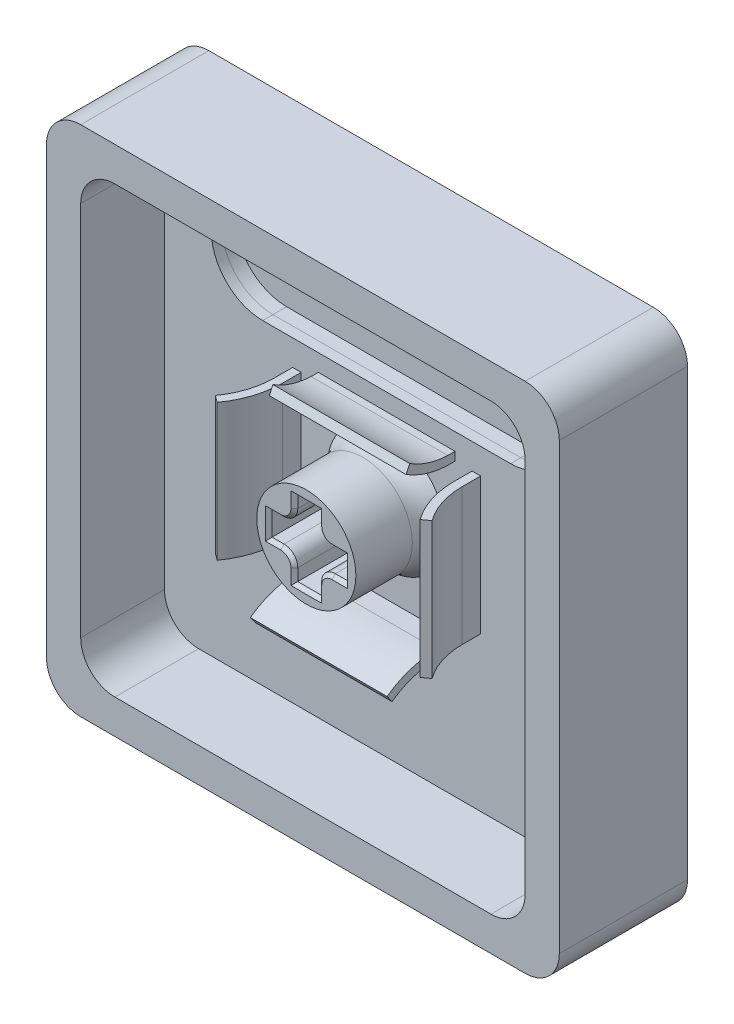
from build123d import *

# Parameters (mm, degrees)
EXTRUDE_1_DEPTH          = 5.5
SKETCH_1_6_R             = 2.9
EXTRUDE_2_DEPTH          = 5.3
EXTRUDE_START            = -2
EXTRUDE_3_DEPTH          = 2
EXTRUDE_4_DEPTH          = 2
CUT_EXTRUDE_1_REACH      = 23.915
EXTRUDE_6_DEPTH          = 1.2
EXTRUDE_9_DEPTH          = 4
EXTRUDE_13_DEPTH         = 4
FILLET_4_R               = 0.8
CHAMFER_1_SIZE           = 0.2
FILLET_5_R               = 2
EXTRUDE_10_DEPTH         = 0.6
PATTERN_CIRCULAR_6_COUNT = 3
PATTERN_CIRCULAR_6_ANGLE = 180


with BuildPart() as part:
    # 草图1 → 凸台-拉伸1 (new body)
    with BuildSketch(Plane.XY):
        with BuildLine():
            ThreePointArc((-15, 13), (-14.414213562, 14.414213562), (-13, 15))
            Line((-13, 15), (13, 15))
            ThreePointArc((13, 15), (14.414213562, 14.414213562), (15, 13))
            Line((15, 13), (15, -13))
            ThreePointArc((15, -13), (14.414213562, -14.414213562), (13, -15))
            Line((13, -15), (-13, -15))
            ThreePointArc((-13, -15), (-14.414213562, -14.414213562), (-15, -13))
            Line((-15, -13), (-15, 13))
        make_face()
        with BuildLine():
            ThreePointArc((-13, -11), (-12.414213562, -12.414213562), (-11, -13))
            Line((-11, -13), (11, -13))
            ThreePointArc((11, -13), (12.414213562, -12.414213562), (13, -11))
            Line((13, -11), (13, 11))
            ThreePointArc((13, 11), (12.414213562, 12.414213562), (11, 13))
            Line((11, 13), (-11, 13))
            ThreePointArc((-11, 13), (-12.414213562, 12.414213562), (-13, 11))
            Line((-13, 11), (-13, -11))
        make_face(mode=Mode.SUBTRACT)
    extrude(amount=EXTRUDE_1_DEPTH)



with BuildPart() as body_2:
    # 草图1<6> → 凸台-拉伸2 (new body)
    with BuildSketch(Plane.XY):
        Circle(SKETCH_1_6_R)
        Polygon((-2.2, -0.7), (-2.2, 0.7), (-0.7, 0.7), (-0.7, 2.2), (0.7, 2.2), (0.7, 0.7), (2.2, 0.7), (2.2, -0.7), (0.7, -0.7), (0.7, -2.2), (-0.7, -2.2), (-0.7, -0.7), align=None, mode=Mode.SUBTRACT)
    extrude(amount=EXTRUDE_2_DEPTH)


with BuildPart() as part_1:
    add(part.part)

    add(body_2.part)  # 凸台-拉伸3 merges body 2
    # 草图1<7> → 凸台-拉伸3 (add)
    with BuildSketch(Plane.XY.offset(EXTRUDE_START)):
        with BuildLine():
            Line((-13, 15), (13, 15))
            ThreePointArc((13, 15), (14.414213562, 14.414213562), (15, 13))
            Line((15, 13), (15, -13))
            ThreePointArc((15, -13), (14.414213562, -14.414213562), (13, -15))
            Line((13, -15), (-13, -15))
            ThreePointArc((-13, -15), (-14.414213562, -14.414213562), (-15, -13))
            Line((-15, -13), (-15, 13))
            ThreePointArc((-15, 13), (-14.414213562, 14.414213562), (-13, 15))
        make_face()
    extrude(amount=EXTRUDE_3_DEPTH)

    # 草图3 → 凸台-拉伸4 (add)
    with BuildSketch(Plane.XY):
        Polygon((0.7, 0.7), (0.7, 2.2), (-0.7, 2.2), (-0.7, 0.7), (-2.2, 0.7), (-2.2, -0.7), (-0.7, -0.7), (-0.7, -2.2), (0.7, -2.2), (0.7, -0.7), (2.2, -0.7), (2.2, 0.7), align=None)
    extrude(amount=EXTRUDE_4_DEPTH)

    # 草图5 → 切除-拉伸1 (cut, up to next)
    with BuildSketch(Plane.XY, mode=Mode.PRIVATE) as cut_extrude_1_sk1:
        with BuildLine():
            Line((7.25, 5.5), (-7.25, 5.5))
            ThreePointArc((-7.25, 5.5), (-10.25, 8.5), (-7.25, 11.5))
            Line((-7.25, 11.5), (7.25, 11.5))
            ThreePointArc((7.25, 11.5), (10.25, 8.5), (7.25, 5.5))
        make_face()
    cut_extrude_1_tool1 = extrude(cut_extrude_1_sk1.sketch, amount=-CUT_EXTRUDE_1_REACH, mode=Mode.PRIVATE) & part_1.part
    add(cut_extrude_1_tool1.solids().sort_by_distance((0, 8.5, 0))[0], mode=Mode.SUBTRACT)

    # 圆角4
    fillet_4_edges = [part_1.edges().sort_by_distance(p)[0] for p in [
        (0.7, 0.7, 3.65),
        (0.7, -0.7, 3.65),
        (-0.7, -0.7, 3.65),
        (-0.7, 0.7, 3.65),
    ]]
    fillet(fillet_4_edges, radius=FILLET_4_R)

    # 倒角1
    chamfer_1_edges = [part_1.edges().sort_by_distance(p)[0] for p in [
        (1.85, 0.7, 5.3),
        (1.85, -0.7, 5.3),
        (0.7, -1.85, 5.3),
        (-0.7, -1.85, 5.3),
        (0.934314575, -0.934314575, 5.3),
        (-0.934314575, -0.934314575, 5.3),
        (0.934314575, 0.934314575, 5.3),
        (-0.934314575, 0.934314575, 5.3),
        (0, -2.2, 5.3),
        (-1.85, -0.7, 5.3),
        (-2.2, 0, 5.3),
        (-0.7, 1.85, 5.3),
        (0, 2.2, 5.3),
        (0.7, 1.85, 5.3),
        (2.2, 0, 5.3),
        (-1.85, 0.7, 5.3),
    ]]
    chamfer(chamfer_1_edges, length=CHAMFER_1_SIZE)

    # 圆角5
    fillet_5_edges = [part_1.edges().sort_by_distance(p)[0] for p in [
        (-2.9, 0, 0),
    ]]
    fillet(fillet_5_edges, radius=FILLET_5_R)


with BuildPart() as body_2_2:
    # 草图6 → 凸台-拉伸6 (new body)
    with BuildSketch(Plane(origin=(0, 0, -2), x_dir=(-1, 0, 0), z_dir=(0, 0, -1))):
        with BuildLine():
            Line((7.25, 5.5), (-7.25, 5.5))
            ThreePointArc((-7.25, 5.5), (-10.25, 8.5), (-7.25, 11.5))
            Line((-7.25, 11.5), (7.25, 11.5))
            ThreePointArc((7.25, 11.5), (10.25, 8.5), (7.25, 5.5))
        make_face()
    extrude(amount=-EXTRUDE_6_DEPTH)


with BuildPart() as body_3:
    # 草图9 → 凸台-拉伸9 (new, symmetric)
    with BuildSketch(Plane(origin=(0, 0, 0), x_dir=(1, 0, 0), z_dir=(0, 1, 0))):
        with BuildLine():
            Line((5.93522135, -4.576441313), (6.340698731, -4.283886885))
            ThreePointArc((6.340698731, -4.283886885), (5.715390829, -3.049095715), (5.5, -1.681862744))
            Line((5.5, -1.681862744), (5.5, 1.163381533))
            Line((5.5, 1.163381533), (5, 1.163381533))
            Line((5, 1.163381533), (5, -1.681862744))
            ThreePointArc((5, -1.681862744), (5.239607953, -3.20281837), (5.93522135, -4.576441313))
        make_face()
    extrude(amount=EXTRUDE_9_DEPTH, both=True)


with BuildPart() as body_4:
    # 草图12 → 凸台-拉伸13 (new, symmetric)
    with BuildSketch(Plane.ZY):
        with BuildLine():
            Line((-1.163381533, 4.5), (-1.163381533, 4))
            Line((-1.163381533, 4), (1.02162113, 4))
            ThreePointArc((1.02162113, 4), (2.293168275, 4.216705202), (3.46547282, 4.754752913))
            Line((3.46547282, 4.754752913), (3.251979945, 5.206882089))
            ThreePointArc((3.251979945, 5.206882089), (2.184122002, 4.704132062), (1.02162113, 4.5))
            Line((1.02162113, 4.5), (-1.163381533, 4.5))
        make_face()
    extrude(amount=EXTRUDE_13_DEPTH, both=True)


with BuildPart() as body_5:
    # 草图10 → 凸台-拉伸10 (new body)
    with BuildSketch(Plane.XY):
        with BuildLine():
            Line((-13, 11), (-13, -11))
            ThreePointArc((-13, -11), (-12.414213562, -12.414213562), (-11, -13))
            Line((-11, -13), (11, -13))
            ThreePointArc((11, -13), (12.414213562, -12.414213562), (13, -11))
            Line((13, -11), (13, 11))
            ThreePointArc((13, 11), (12.414213562, 12.414213562), (11, 13))
            Line((11, 13), (-11, 13))
            ThreePointArc((-11, 13), (-12.414213562, 12.414213562), (-13, 11))
        make_face()
        with BuildLine():
            Line((7.25, 5.5), (-7.25, 5.5))
            ThreePointArc((-7.25, 5.5), (-10.25, 8.5), (-7.25, 11.5))
            Line((-7.25, 11.5), (7.25, 11.5))
            ThreePointArc((7.25, 11.5), (10.25, 8.5), (7.25, 5.5))
        make_face(mode=Mode.SUBTRACT)
    extrude(amount=EXTRUDE_10_DEPTH)


with BuildPart() as pattern_circular_6_1:
    # 阵列(圆周)6: pattern copy
    add(body_3.part.rotate(Axis((0, 0, 0), (0, 0, -1)), 1 * PATTERN_CIRCULAR_6_ANGLE / (PATTERN_CIRCULAR_6_COUNT - 1)))


with BuildPart() as pattern_circular_6_2:
    # 阵列(圆周)6: pattern copy
    add(body_3.part.rotate(Axis((0, 0, 0), (0, 0, -1)), 2 * PATTERN_CIRCULAR_6_ANGLE / (PATTERN_CIRCULAR_6_COUNT - 1)))


solid = Compound([part_1.part, body_2_2.part, body_3.part, body_4.part, body_5.part, pattern_circular_6_1.part, pattern_circular_6_2.part])
